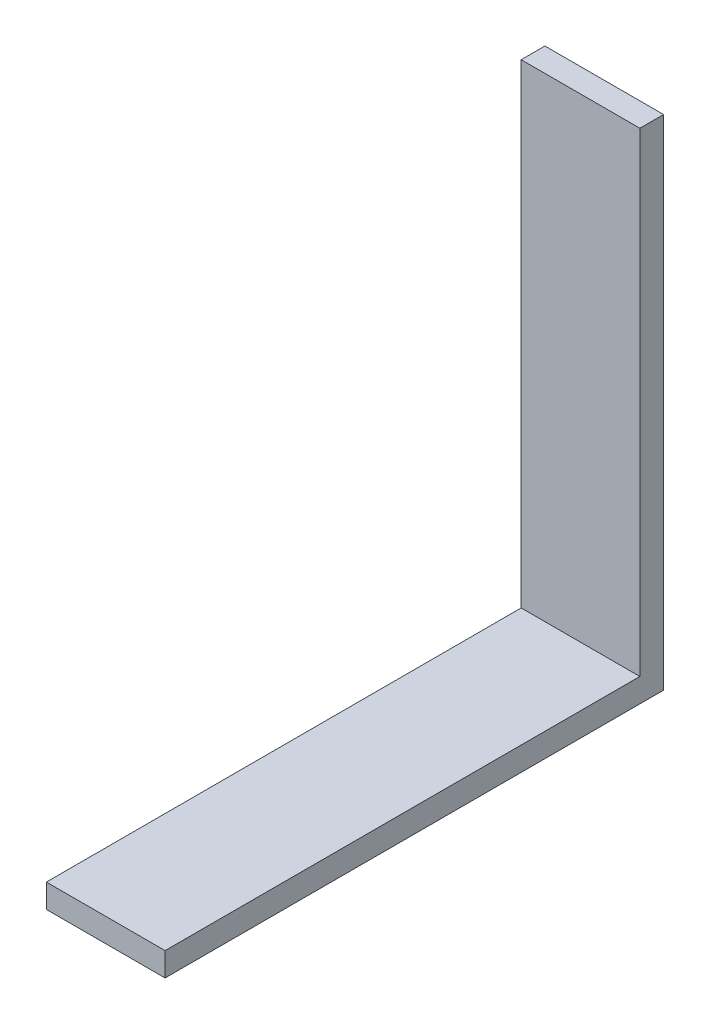
from build123d import *

# Parameters (mm, degrees)
BOSS_EXTRUDE1_DEPTH = 5


with BuildPart() as part:
    # Sketch1 → Boss-Extrude1 (new, symmetric)
    with BuildSketch(Plane(origin=(0, 0, 0), x_dir=(0, 0, -1), z_dir=(1, 0, 0))):
        Polygon((-42, 0), (0, 0), (0, 42), (-2, 42), (-2, 2), (-42, 2), align=None)
    extrude(amount=BOSS_EXTRUDE1_DEPTH, both=True)


solid = part.part
